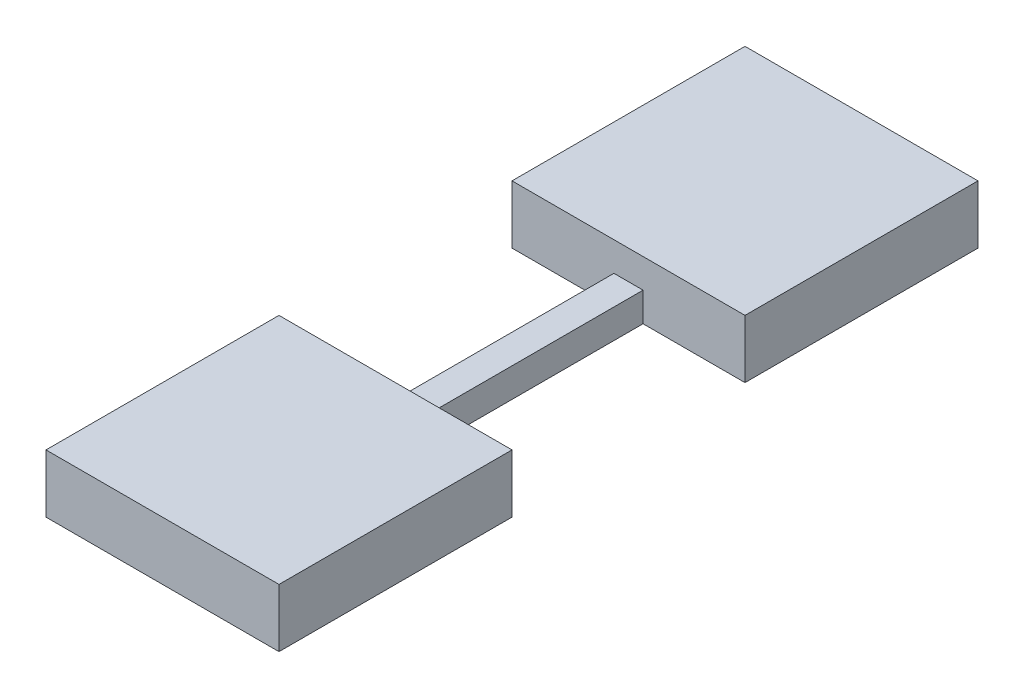
from build123d import *

# Parameters (mm, degrees)
BOSS_EXTRUDE1_DEPTH = 1
SKETCH4_W           = 0.5
SKETCH4_H           = 4
CUT_EXTRUDE1_DEPTH  = 0.5


with BuildPart() as part:
    # Sketch3 → Boss-Extrude1 (new body)
    with BuildSketch(Plane(origin=(0, 0, 0), x_dir=(1, 0, 0), z_dir=(0, 1, 0))):
        Polygon((-2.031413613, 2.77486911), (-2.031413613, -1.22513089), (1.968586387, -1.22513089), (1.968586387, 2.77486911), (0.218586387, 2.77486911), (0.218586387, 6.77486911), (1.968586387, 6.77486911), (1.968586387, 10.77486911), (-2.031413613, 10.77486911), (-2.031413613, 6.77486911), (-0.281413613, 6.77486911), (-0.281413613, 2.77486911), align=None)
    extrude(amount=BOSS_EXTRUDE1_DEPTH)

    # Sketch4 → Cut-Extrude1 (cut)
    with BuildSketch(Plane(origin=(0, 1, 0), x_dir=(1, 0, 0), z_dir=(0, 1, 0))):
        with Locations((-0.031413613, 4.77486911)):
            Rectangle(SKETCH4_W, SKETCH4_H)
    extrude(amount=-CUT_EXTRUDE1_DEPTH, mode=Mode.SUBTRACT)


solid = part.part
